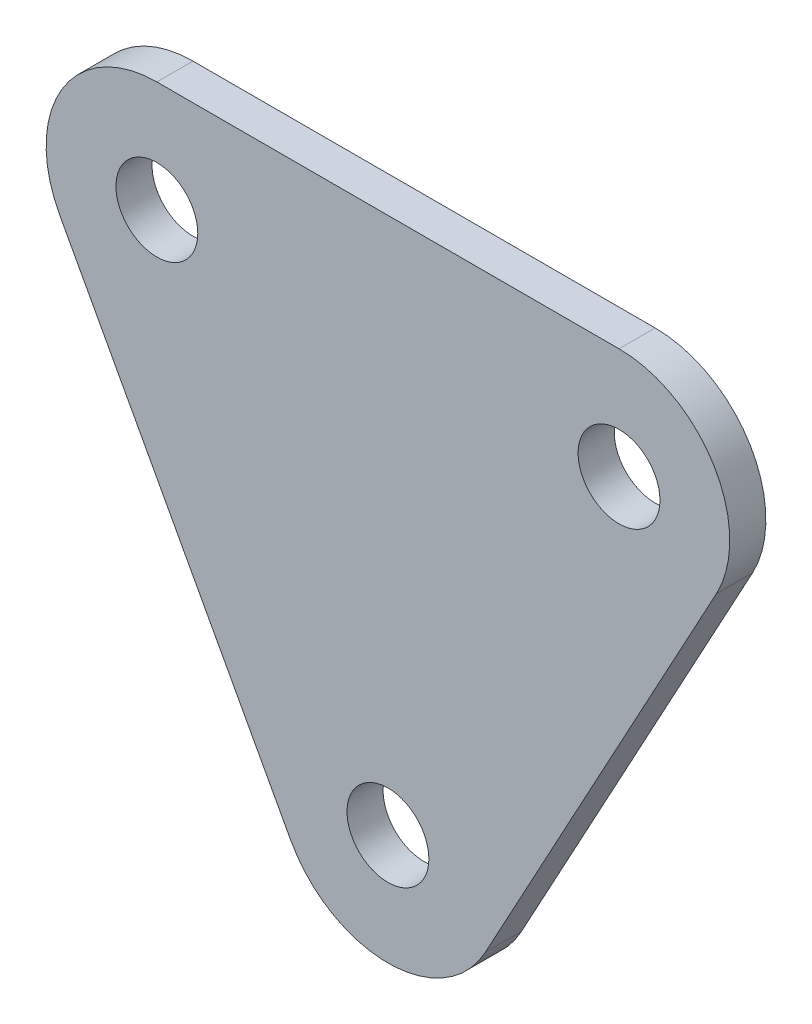
from build123d import *

# Parameters (mm, degrees)
IZIM2_R                     = 8.5
Y_KSEKLIK_EKSTR_ZYON1_DEPTH = 7.5


with BuildPart() as part:
    # Çizim2 → Yükseklik-Ekstrüzyon1 (new body)
    with BuildSketch(Plane.XY):
        with BuildLine():
            Line((38.639725863, 0), (134.639725863, 0))
            ThreePointArc((134.639725863, 0), (154.403425521, -11.235809598), (154.857458544, -33.965549929))
            Line((154.857458544, -33.965549929), (106.857458544, -122.465549929))
            ThreePointArc((106.857458544, -122.465549929), (86.639725863, -134.5), (66.421993182, -122.465549929))
            Line((66.421993182, -122.465549929), (18.421993182, -33.965549929))
            ThreePointArc((18.421993182, -33.965549929), (18.876026204, -11.235809598), (38.639725863, 0))
        make_face()
        with Locations((86.639725863, -111.5)):
            Circle(IZIM2_R, mode=Mode.SUBTRACT)
        with Locations((38.639725863, -23)):
            Circle(IZIM2_R, mode=Mode.SUBTRACT)
        with Locations((134.639725863, -23)):
            Circle(IZIM2_R, mode=Mode.SUBTRACT)
    extrude(amount=Y_KSEKLIK_EKSTR_ZYON1_DEPTH)


solid = part.part
